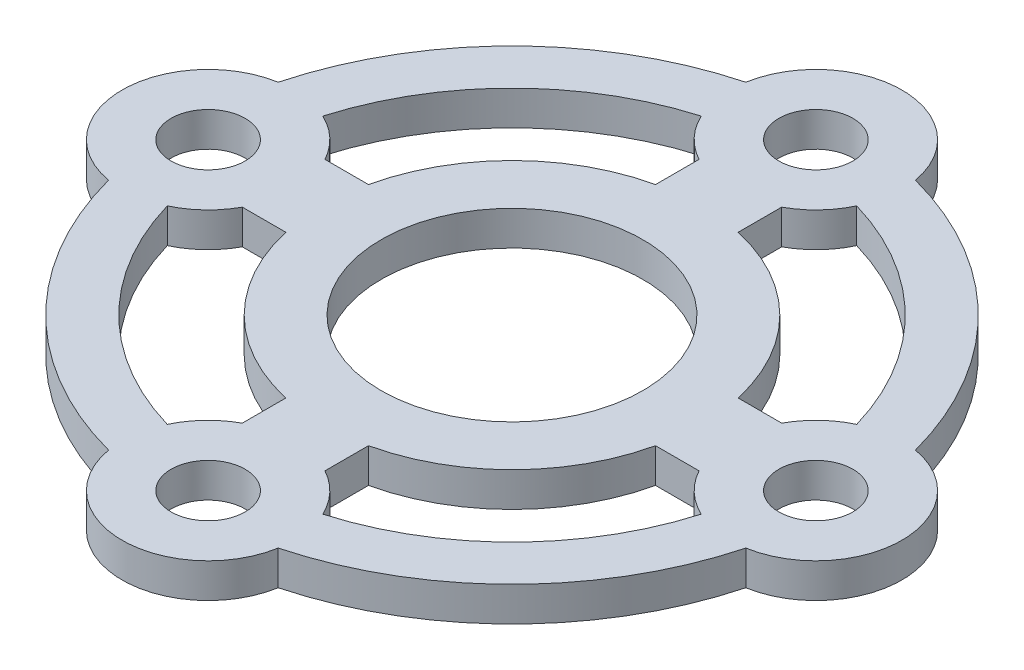
from build123d import *

# Parameters (mm, degrees)
SKETCH1_R                = 7.6
BOSS_EXTRUDE1_DEPTH      = 2
M4_CLEARANCE_HOLE1_D     = 4.3
M4_CLEARANCE_HOLE1_DEPTH = 8
M4_CLEARANCE_HOLE1_TIP   = 1.291850331


with BuildPart() as part:
    # Sketch1 → Boss-Extrude1 (new body)
    with BuildSketch(Plane(origin=(0, 0, 0), x_dir=(1, 0, 0), z_dir=(0, 1, 0))):
        with BuildLine():
            ThreePointArc((-4.926264158, -18.505524079), (0, -22.65), (4.926264158, -18.505524079))
            ThreePointArc((4.926264158, -18.505524079), (13.54109486, -13.54109486), (18.505524079, -4.926264158))
            ThreePointArc((18.505524079, -4.926264158), (22.65, 0), (18.505524079, 4.926264158))
            ThreePointArc((18.505524079, 4.926264158), (13.54109486, 13.54109486), (4.926264158, 18.505524079))
            ThreePointArc((4.926264158, 18.505524079), (0, 22.65), (-4.926264158, 18.505524079))
            ThreePointArc((-4.926264158, 18.505524079), (-13.54109486, 13.54109486), (-18.505524079, 4.926264158))
            ThreePointArc((-18.505524079, 4.926264158), (-22.65, 0), (-18.505524079, -4.926264158))
            ThreePointArc((-18.505524079, -4.926264158), (-13.54109486, -13.54109486), (-4.926264158, -18.505524079))
        make_face()
        with BuildLine():
            ThreePointArc((-4.516771305, -15.505524079), (-11.419774516, -11.419774516), (-15.505524079, -4.516771305))
            ThreePointArc((-15.505524079, -4.516771305), (-14.21735127, -3.635508588), (-13.26365756, -2.4))
            Line((-13.26365756, -2.4), (-10.73498952, -2.4))
            ThreePointArc((-10.73498952, -2.4), (-7.778174593, -7.778174593), (-2.4, -10.73498952))
            Line((-2.4, -10.73498952), (-2.4, -13.26365756))
            ThreePointArc((-2.4, -13.26365756), (-3.635508588, -14.21735127), (-4.516771305, -15.505524079))
        make_face(mode=Mode.SUBTRACT)
        with BuildLine():
            ThreePointArc((4.516771305, -15.505524079), (3.635508588, -14.21735127), (2.4, -13.26365756))
            Line((2.4, -13.26365756), (2.4, -10.73498952))
            ThreePointArc((2.4, -10.73498952), (7.778174593, -7.778174593), (10.73498952, -2.4))
            Line((10.73498952, -2.4), (13.26365756, -2.4))
            ThreePointArc((13.26365756, -2.4), (14.21735127, -3.635508588), (15.505524079, -4.516771305))
            ThreePointArc((15.505524079, -4.516771305), (11.419774516, -11.419774516), (4.516771305, -15.505524079))
        make_face(mode=Mode.SUBTRACT)
        with BuildLine():
            Line((-10.73498952, 2.4), (-13.26365756, 2.4))
            ThreePointArc((-13.26365756, 2.4), (-14.21735127, 3.635508588), (-15.505524079, 4.516771305))
            ThreePointArc((-15.505524079, 4.516771305), (-11.419774516, 11.419774516), (-4.516771305, 15.505524079))
            ThreePointArc((-4.516771305, 15.505524079), (-3.635508588, 14.21735127), (-2.4, 13.26365756))
            Line((-2.4, 13.26365756), (-2.4, 10.73498952))
            ThreePointArc((-2.4, 10.73498952), (-7.778174593, 7.778174593), (-10.73498952, 2.4))
        make_face(mode=Mode.SUBTRACT)
        with Locations(Location((0, 0, 0), (0, 0, 270))):
            Circle(SKETCH1_R, mode=Mode.SUBTRACT)
        with BuildLine():
            Line((2.4, 10.73498952), (2.4, 13.26365756))
            ThreePointArc((2.4, 13.26365756), (3.635508588, 14.21735127), (4.516771305, 15.505524079))
            ThreePointArc((4.516771305, 15.505524079), (11.419774516, 11.419774516), (15.505524079, 4.516771305))
            ThreePointArc((15.505524079, 4.516771305), (14.21735127, 3.635508588), (13.26365756, 2.4))
            Line((13.26365756, 2.4), (10.73498952, 2.4))
            ThreePointArc((10.73498952, 2.4), (7.778174593, 7.778174593), (2.4, 10.73498952))
        make_face(mode=Mode.SUBTRACT)
    extrude(amount=BOSS_EXTRUDE1_DEPTH)

    # M4 Clearance Hole1
    with Locations(Plane(origin=(0, 0, 0), x_dir=(-1, 0, 0), z_dir=(0, -1, 0))):
        with Locations((-17.65, 0), (0, 17.65), (17.65, 0), (0, -17.65)):
            Hole(M4_CLEARANCE_HOLE1_D / 2, depth=M4_CLEARANCE_HOLE1_DEPTH)
            with Locations((0, 0, -(M4_CLEARANCE_HOLE1_DEPTH + M4_CLEARANCE_HOLE1_TIP / 2))):  # 118° drill point
                Cone(0, M4_CLEARANCE_HOLE1_D / 2, M4_CLEARANCE_HOLE1_TIP, mode=Mode.SUBTRACT)


solid = part.part
